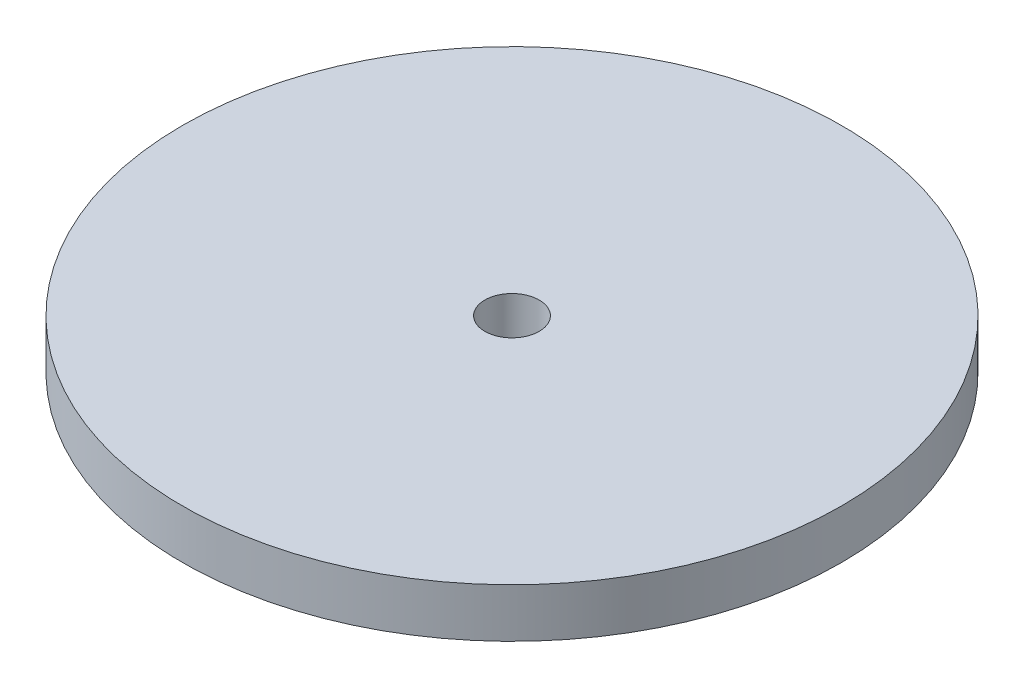
from build123d import *

# Parameters (mm, degrees)
SKETCH1_W = 18.35
SKETCH1_H = 2.975469228


with BuildPart() as part:
    # Sketch1 → Revolve1 (revolve)
    with BuildSketch(Plane.XY):
        with Locations((10.960281537, 7.833519813)):
            Rectangle(SKETCH1_W, SKETCH1_H)
    revolve(axis=Axis((0.135281537, 9.321254427, 0), (0, -1, 0)))


solid = part.part
